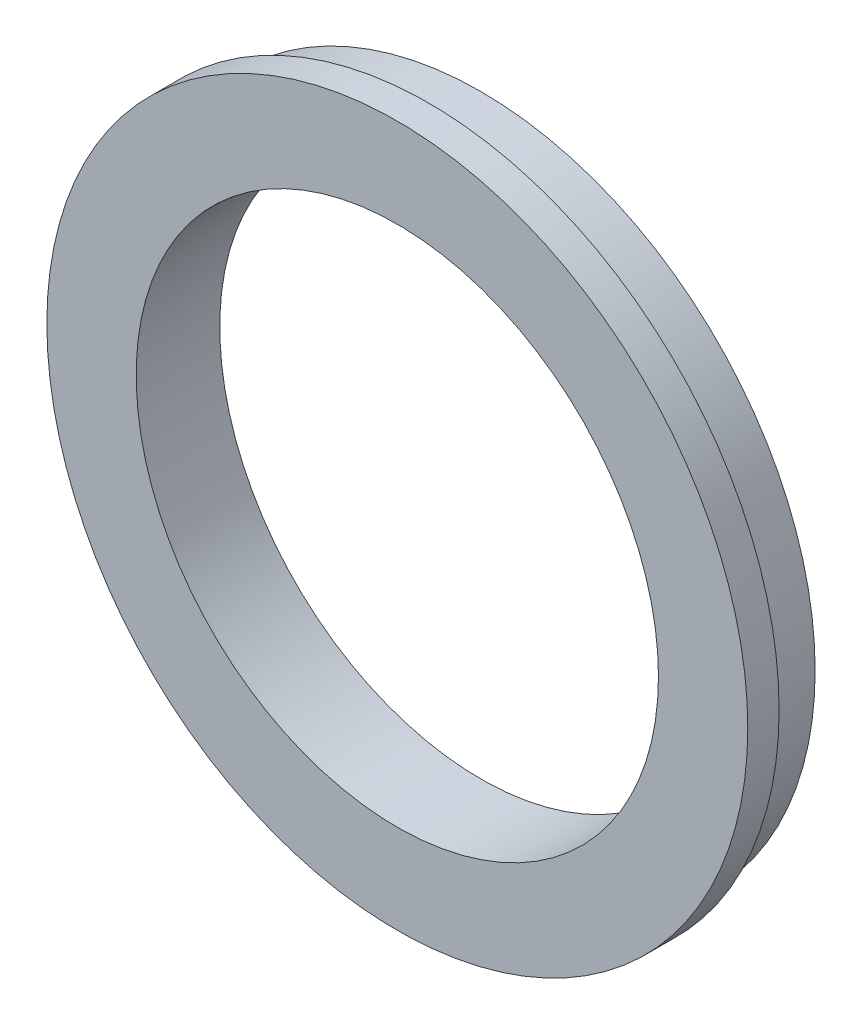
from build123d import *

# Parameters (mm, degrees)
SKETCH_1_R      = 16
SKETCH_1_R_2    = 12.5
EXTRUDE_1_DEPTH = 4
EXTRUDE_START   = -1.5
SKETCH_2_R      = 16.775
SKETCH_2_R_2    = 12.5
EXTRUDE_2_DEPTH = 1.5


with BuildPart() as part:
    # 草图1 → 凸台-拉伸1 (new body)
    with BuildSketch(Plane.XY):
        Circle(SKETCH_1_R)
        Circle(SKETCH_1_R_2, mode=Mode.SUBTRACT)
    extrude(amount=EXTRUDE_1_DEPTH)

    # 草图2 → 凸台-拉伸2 (add)
    with BuildSketch(Plane.XY.offset(4).offset(EXTRUDE_START)):
        Circle(SKETCH_2_R)
        Circle(SKETCH_2_R_2, mode=Mode.SUBTRACT)
    extrude(amount=EXTRUDE_2_DEPTH)


solid = part.part
